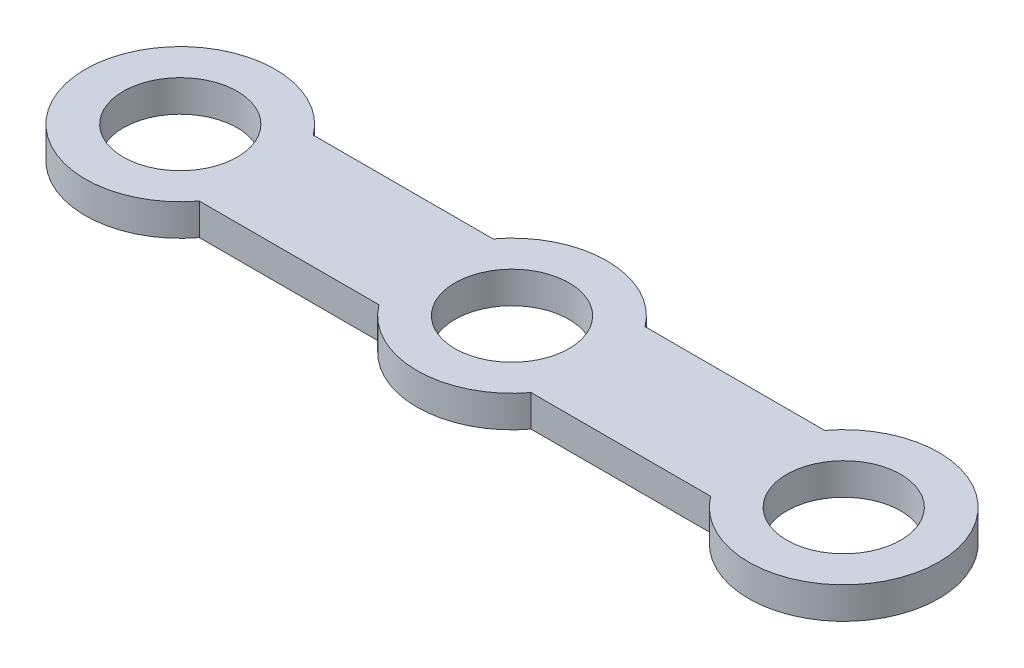
from build123d import *

# Parameters (mm, degrees)
SKETCH1_R           = 90
BOSS_EXTRUDE1_DEPTH = 50


with BuildPart() as part:
    # Sketch1 → Boss-Extrude1 (new body)
    with BuildSketch(Plane(origin=(0, 0, 0), x_dir=(1, 0, 0), z_dir=(0, 1, 0))):
        with BuildLine():
            ThreePointArc((120, 90), (-150, 0), (120, -90))
            Line((120, -90), (403.5455, -90))
            ThreePointArc((403.5455, -90), (523.5455, -150), (643.5455, -90))
            Line((643.5455, -90), (927.091, -90))
            ThreePointArc((927.091, -90), (1197.091, 0), (927.091, 90))
            Line((927.091, 90), (643.5455, 90))
            ThreePointArc((643.5455, 90), (523.5455, 150), (403.5455, 90))
            Line((403.5455, 90), (120, 90))
        make_face()
        with Locations(Location((0, 0, 0), (0, 0, 270))):
            Circle(SKETCH1_R, mode=Mode.SUBTRACT)
        with Locations(Location((523.5455, 0, 0), (0, 0, 270))):
            Circle(SKETCH1_R, mode=Mode.SUBTRACT)
        with Locations(Location((1047.091, 0, 0), (0, 0, 270))):
            Circle(SKETCH1_R, mode=Mode.SUBTRACT)
    extrude(amount=BOSS_EXTRUDE1_DEPTH)


solid = part.part
